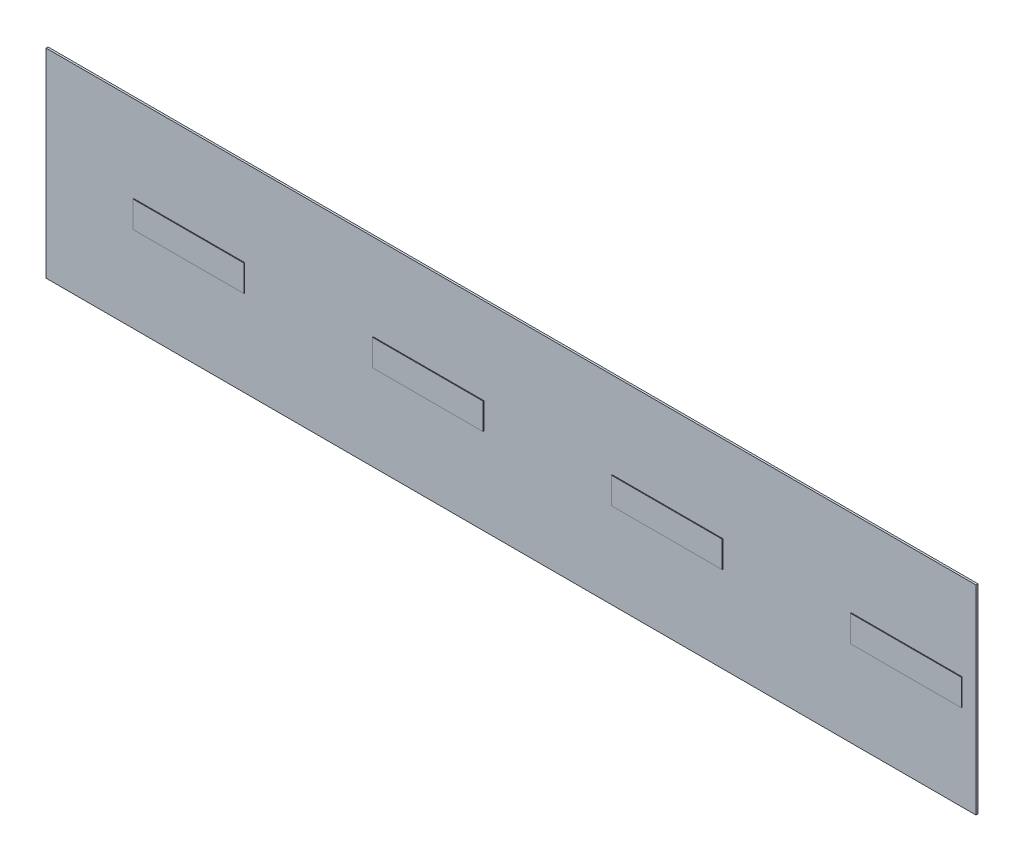
from build123d import *

# Parameters (mm, degrees)
SKETCH1_W           = 700
SKETCH1_H           = 150
BOSS_EXTRUDE1_DEPTH = 1.5
SKETCH2_W           = 83.358255446
SKETCH2_H           = 19.874992792
BOSS_EXTRUDE2_DEPTH = 0.6


with BuildPart() as part:
    # Sketch1 → Boss-Extrude1 (new body)
    with BuildSketch(Plane.XY):
        with Locations((350, 75)):
            Rectangle(SKETCH1_W, SKETCH1_H)
    extrude(amount=BOSS_EXTRUDE1_DEPTH)

    # Sketch2 → Boss-Extrude2 (add)
    with BuildSketch(Plane.XY.offset(1.5)):
        with Locations((287.844267931, 75)):
            Rectangle(SKETCH2_W, SKETCH2_H)
        with Locations((107.844267931, 75)):
            Rectangle(SKETCH2_W, SKETCH2_H)
        with Locations((467.844267931, 75)):
            Rectangle(SKETCH2_W, SKETCH2_H)
        with Locations((647.844267931, 75)):
            Rectangle(SKETCH2_W, SKETCH2_H)
    extrude(amount=BOSS_EXTRUDE2_DEPTH)


solid = part.part
